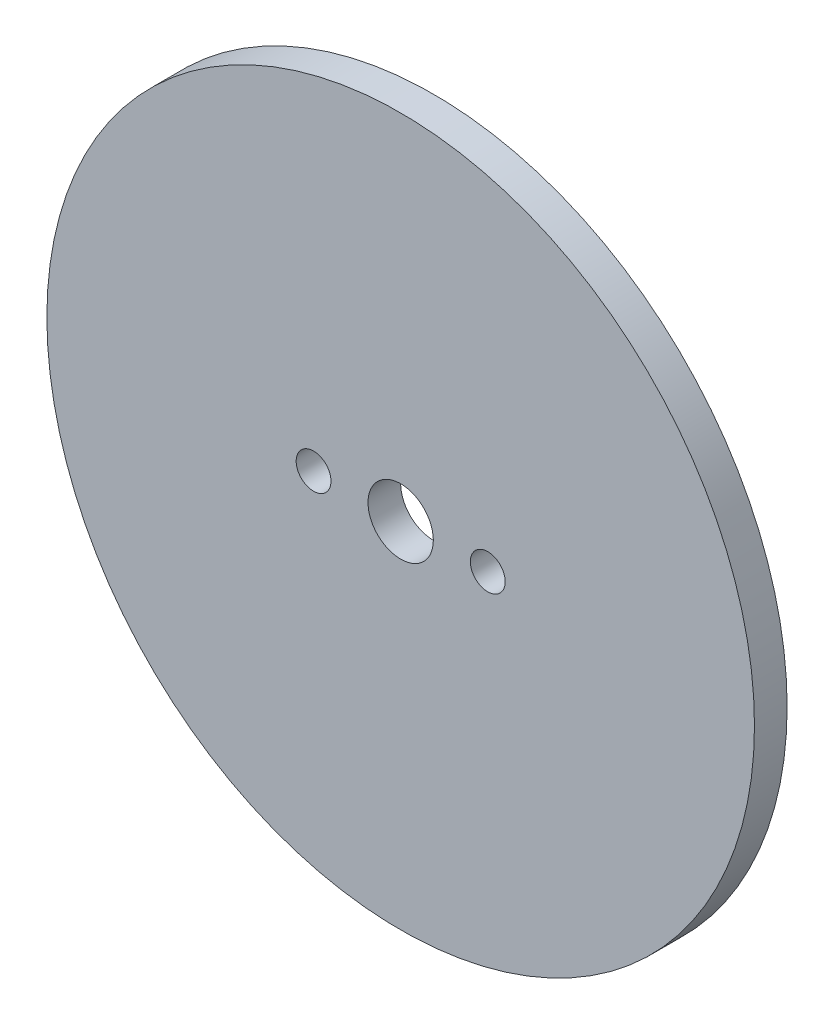
from build123d import *

# Parameters (mm, degrees)
ESBO_O1_R                = 32.5
ESBO_O1_R_2              = 3
ESBO_O1_R_3              = 1.6
RESSALTO_EXTRUS_O1_DEPTH = 1.5


with BuildPart() as part:
    # Esboço1 → Ressalto-extrusão1 (new, symmetric)
    with BuildSketch(Plane.XY):
        Circle(ESBO_O1_R)
        Circle(ESBO_O1_R_2, mode=Mode.SUBTRACT)
        with Locations((-8, 0)):
            Circle(ESBO_O1_R_3, mode=Mode.SUBTRACT)
        with Locations((8, 0)):
            Circle(ESBO_O1_R_3, mode=Mode.SUBTRACT)
    extrude(amount=RESSALTO_EXTRUS_O1_DEPTH, both=True)


solid = part.part
